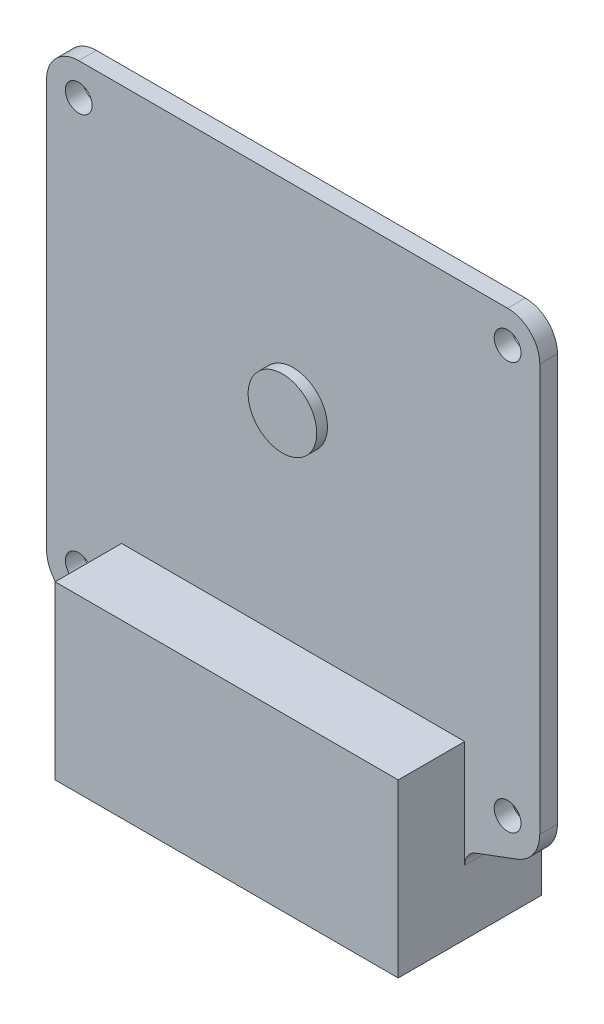
from build123d import *

# Parameters (mm, degrees)
SKETCH1_R           = 3.2
SKETCH1_R_2         = 1.25
BOSS_EXTRUDE1_DEPTH = 1.65
SKETCH2_W           = 32
SKETCH2_H           = 16
BOSS_EXTRUDE2_DEPTH = 6.2
SKETCH1_2_R         = 3.2
BOSS_EXTRUDE3_DEPTH = 2.65
SKETCH3_W           = 32.03
SKETCH3_H           = 10
BOSS_EXTRUDE4_DEPTH = 5.5


with BuildPart() as part:
    # Sketch1 → Boss-Extrude1 (new body)
    with BuildSketch(Plane.XY):
        with BuildLine():
            Line((-20, 18), (20, 18))
            ThreePointArc((20, 18), (22.121320344, 17.121320344), (23, 15))
            Line((23, 15), (23, -23))
            ThreePointArc((23, -23), (22.416236427, -24.864680631), (20.873373788, -26.063592072))
            Line((20.873373788, -26.063592072), (17.047054496, -27.491625922))
            ThreePointArc((17.047054496, -27.491625922), (16.287418762, -28.081915652), (16, -29))
            Line((16, -29), (16, -35))
            Line((16, -35), (-16, -35))
            Line((-16, -35), (-16, -29))
            ThreePointArc((-16, -29), (-16.287418762, -28.081915652), (-17.047054496, -27.491625922))
            Line((-17.047054496, -27.491625922), (-20.873373788, -26.063592072))
            ThreePointArc((-20.873373788, -26.063592072), (-22.416236427, -24.864680631), (-23, -23))
            Line((-23, -23), (-23, 15))
            ThreePointArc((-23, 15), (-22.121320344, 17.121320344), (-20, 18))
        make_face()
        Circle(SKETCH1_R, mode=Mode.SUBTRACT)
        with Locations((20, 15)):
            Circle(SKETCH1_R_2, mode=Mode.SUBTRACT)
        with Locations((-20, 15)):
            Circle(SKETCH1_R_2, mode=Mode.SUBTRACT)
        with Locations((-20, -23)):
            Circle(SKETCH1_R_2, mode=Mode.SUBTRACT)
        with Locations((20, -23)):
            Circle(SKETCH1_R_2, mode=Mode.SUBTRACT)
    extrude(amount=BOSS_EXTRUDE1_DEPTH)

    # Sketch2 → Boss-Extrude2 (add)
    with BuildSketch(Plane.XY.offset(1.65)):
        with Locations((0, -27)):
            Rectangle(SKETCH2_W, SKETCH2_H)
    extrude(amount=BOSS_EXTRUDE2_DEPTH)

    # Sketch1<2> → Boss-Extrude3 (add)
    with BuildSketch(Plane.XY):
        Circle(SKETCH1_2_R)
    extrude(amount=BOSS_EXTRUDE3_DEPTH)

    # Sketch3 → Boss-Extrude4 (add)
    with BuildSketch(Plane(origin=(0, 0, 0), x_dir=(-1, 0, 0), z_dir=(0, 0, -1))):
        with Locations((0.015, -30)):
            Rectangle(SKETCH3_W, SKETCH3_H)
    extrude(amount=BOSS_EXTRUDE4_DEPTH)


solid = part.part
